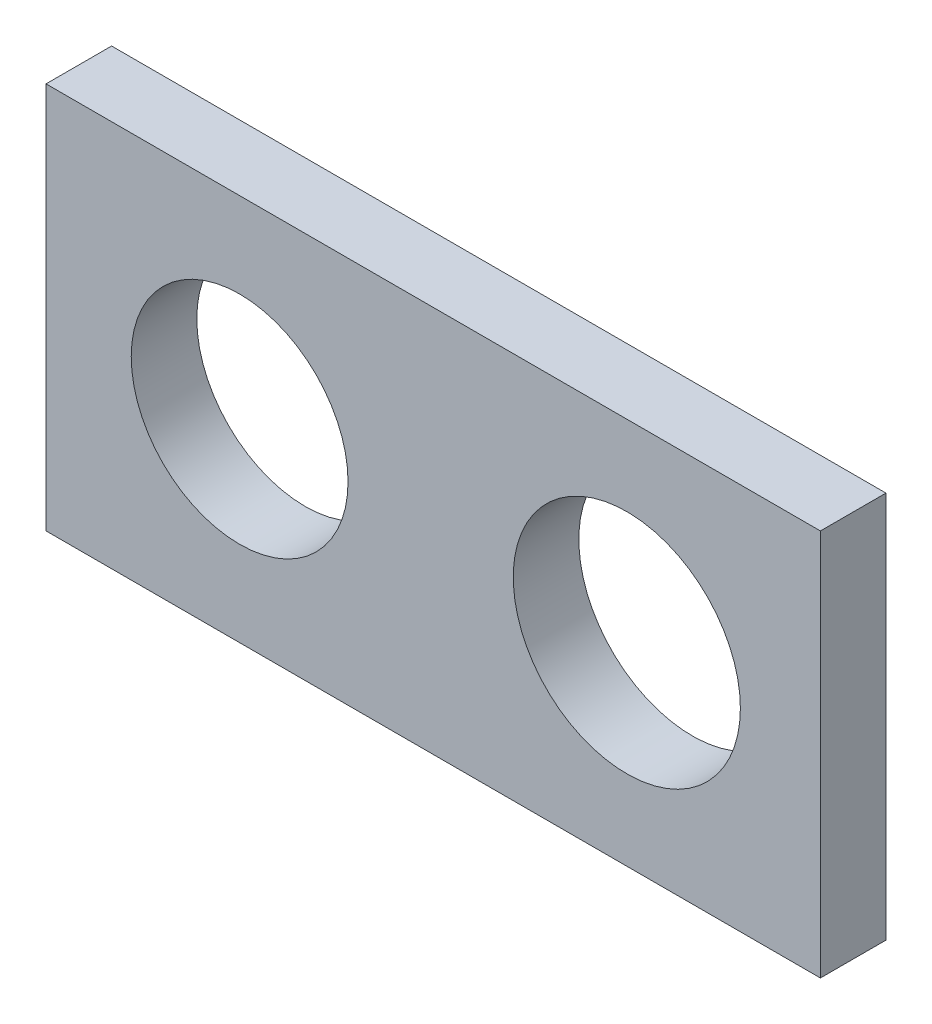
from build123d import *

# Parameters (mm, degrees)
SKETCH1_W           = 30
SKETCH1_H           = 15
SKETCH1_R           = 4.2
SKETCH1_R_2         = 4.4
BOSS_EXTRUDE1_DEPTH = 2.54


with BuildPart() as part:
    # Sketch1 → Boss-Extrude1 (new body)
    with BuildSketch(Plane.XY):
        Rectangle(SKETCH1_W, SKETCH1_H)
        with Locations((-7.5, 0)):
            Circle(SKETCH1_R, mode=Mode.SUBTRACT)
        with Locations((7.5, 0)):
            Circle(SKETCH1_R_2, mode=Mode.SUBTRACT)
    extrude(amount=BOSS_EXTRUDE1_DEPTH)


solid = part.part
